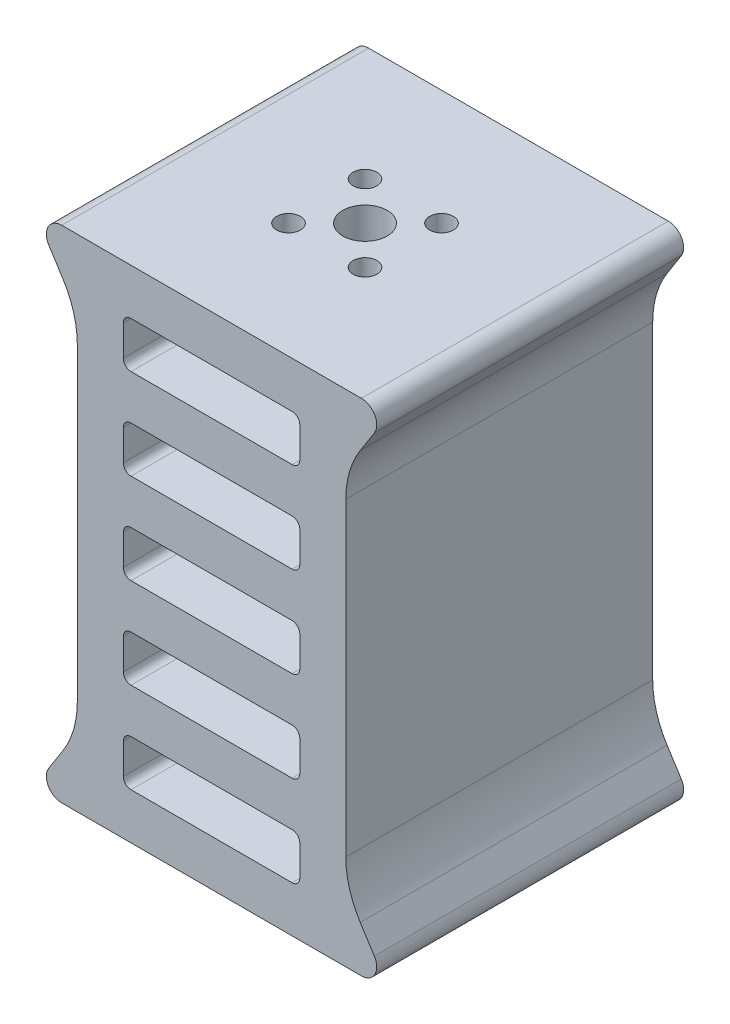
from build123d import *

# Parameters (mm, degrees)
BOSS_EXTRUDE1_DEPTH      = 20
BOSS_EXTRUDE1_DEPTH_BACK = 20
SKETCH1_W                = 35
SKETCH1_H                = 65.2
CUT_EXTRUDE3_REACH       = 92.614
SKETCH7_R                = 1.55
SKETCH7_R_2              = 2.9
CUT_EXTRUDE4_DEPTH       = 10
BOSS_EXTRUDE2_DEPTH      = 40


with BuildPart() as part:
    # Sketch1 → Boss-Extrude1 (new, two sides: drawn at the far end of the back side and taken through both)
    with BuildSketch(Plane.XY.offset(-BOSS_EXTRUDE1_DEPTH_BACK)):
        with Locations((6.633557164, -45.043181818)):
            Rectangle(SKETCH1_W, SKETCH1_H)
    extrude(amount=BOSS_EXTRUDE1_DEPTH + BOSS_EXTRUDE1_DEPTH_BACK)

    # Sketch5 → Cut-Extrude3 (cut, up to next)
    with BuildSketch(Plane.XY.offset(20), mode=Mode.PRIVATE) as cut_extrude3_sk1:
        with BuildLine():
            Line((-4.866442836, -31.243181818), (-4.866442836, -35.243181818))
            ThreePointArc((-4.866442836, -35.243181818), (-4.573549617, -35.950288599), (-3.866442836, -36.243181818))
            Line((-3.866442836, -36.243181818), (17.133557164, -36.243181818))
            ThreePointArc((17.133557164, -36.243181818), (17.840663945, -35.950288599), (18.133557164, -35.243181818))
            Line((18.133557164, -35.243181818), (18.133557164, -31.243181818))
            ThreePointArc((18.133557164, -31.243181818), (17.840663945, -30.536075037), (17.133557164, -30.243181818))
            Line((17.133557164, -30.243181818), (-3.866442836, -30.243181818))
            ThreePointArc((-3.866442836, -30.243181818), (-4.573549617, -30.536075037), (-4.866442836, -31.243181818))
        make_face()
    cut_extrude3_tool1 = extrude(cut_extrude3_sk1.sketch, amount=-CUT_EXTRUDE3_REACH, mode=Mode.PRIVATE) & part.part
    # Sketch5 → Cut-Extrude3 (cut, up to next)
    with BuildSketch(Plane.XY.offset(20), mode=Mode.PRIVATE) as cut_extrude3_sk2:
        with BuildLine():
            Line((-4.866442836, -43.043181818), (-4.866442836, -47.043181818))
            ThreePointArc((-4.866442836, -47.043181818), (-4.573549617, -47.750288599), (-3.866442836, -48.043181818))
            Line((-3.866442836, -48.043181818), (17.133557164, -48.043181818))
            ThreePointArc((17.133557164, -48.043181818), (17.840663945, -47.750288599), (18.133557164, -47.043181818))
            Line((18.133557164, -47.043181818), (18.133557164, -43.043181818))
            ThreePointArc((18.133557164, -43.043181818), (17.840663945, -42.336075037), (17.133557164, -42.043181818))
            Line((17.133557164, -42.043181818), (-3.866442836, -42.043181818))
            ThreePointArc((-3.866442836, -42.043181818), (-4.573549617, -42.336075037), (-4.866442836, -43.043181818))
        make_face()
    cut_extrude3_tool2 = extrude(cut_extrude3_sk2.sketch, amount=-CUT_EXTRUDE3_REACH, mode=Mode.PRIVATE) & part.part
    # Sketch5 → Cut-Extrude3 (cut, up to next)
    with BuildSketch(Plane.XY.offset(20), mode=Mode.PRIVATE) as cut_extrude3_sk3:
        with BuildLine():
            Line((-3.866442836, -18.443181818), (17.133557164, -18.443181818))
            ThreePointArc((17.133557164, -18.443181818), (17.840663945, -18.736075037), (18.133557164, -19.443181818))
            Line((18.133557164, -19.443181818), (18.133557164, -23.443181818))
            ThreePointArc((18.133557164, -23.443181818), (17.840663945, -24.150288599), (17.133557164, -24.443181818))
            Line((17.133557164, -24.443181818), (-3.866442836, -24.443181818))
            ThreePointArc((-3.866442836, -24.443181818), (-4.573549617, -24.150288599), (-4.866442836, -23.443181818))
            Line((-4.866442836, -23.443181818), (-4.866442836, -19.443181818))
            ThreePointArc((-4.866442836, -19.443181818), (-4.573549617, -18.736075037), (-3.866442836, -18.443181818))
        make_face()
    cut_extrude3_tool3 = extrude(cut_extrude3_sk3.sketch, amount=-CUT_EXTRUDE3_REACH, mode=Mode.PRIVATE) & part.part
    # Sketch5 → Cut-Extrude3 (cut, up to next)
    with BuildSketch(Plane.XY.offset(20), mode=Mode.PRIVATE) as cut_extrude3_sk4:
        with BuildLine():
            Line((-4.866442836, -54.843181818), (-4.866442836, -58.843181818))
            ThreePointArc((-4.866442836, -58.843181818), (-4.573549617, -59.550288599), (-3.866442836, -59.843181818))
            Line((-3.866442836, -59.843181818), (17.133557164, -59.843181818))
            ThreePointArc((17.133557164, -59.843181818), (17.840663945, -59.550288599), (18.133557164, -58.843181818))
            Line((18.133557164, -58.843181818), (18.133557164, -54.843181818))
            ThreePointArc((18.133557164, -54.843181818), (17.840663945, -54.136075037), (17.133557164, -53.843181818))
            Line((17.133557164, -53.843181818), (-3.866442836, -53.843181818))
            ThreePointArc((-3.866442836, -53.843181818), (-4.573549617, -54.136075037), (-4.866442836, -54.843181818))
        make_face()
    cut_extrude3_tool4 = extrude(cut_extrude3_sk4.sketch, amount=-CUT_EXTRUDE3_REACH, mode=Mode.PRIVATE) & part.part
    # Sketch5 → Cut-Extrude3 (cut, up to next)
    with BuildSketch(Plane.XY.offset(20), mode=Mode.PRIVATE) as cut_extrude3_sk5:
        with BuildLine():
            Line((-4.866442836, -66.643181818), (-4.866442836, -70.643181818))
            ThreePointArc((-4.866442836, -70.643181818), (-4.573549617, -71.350288599), (-3.866442836, -71.643181818))
            Line((-3.866442836, -71.643181818), (17.133557164, -71.643181818))
            ThreePointArc((17.133557164, -71.643181818), (17.840663945, -71.350288599), (18.133557164, -70.643181818))
            Line((18.133557164, -70.643181818), (18.133557164, -66.643181818))
            ThreePointArc((18.133557164, -66.643181818), (17.840663945, -65.936075037), (17.133557164, -65.643181818))
            Line((17.133557164, -65.643181818), (-3.866442836, -65.643181818))
            ThreePointArc((-3.866442836, -65.643181818), (-4.573549617, -65.936075037), (-4.866442836, -66.643181818))
        make_face()
    cut_extrude3_tool5 = extrude(cut_extrude3_sk5.sketch, amount=-CUT_EXTRUDE3_REACH, mode=Mode.PRIVATE) & part.part
    add(cut_extrude3_tool1.solids().sort_by_distance((6.633557, -33.243182, 20))[0], mode=Mode.SUBTRACT)
    add(cut_extrude3_tool2.solids().sort_by_distance((6.633557, -45.043182, 20))[0], mode=Mode.SUBTRACT)
    add(cut_extrude3_tool3.solids().sort_by_distance((6.633557, -21.443182, 20))[0], mode=Mode.SUBTRACT)
    add(cut_extrude3_tool4.solids().sort_by_distance((6.633557, -56.843182, 20))[0], mode=Mode.SUBTRACT)
    add(cut_extrude3_tool5.solids().sort_by_distance((6.633557, -68.643182, 20))[0], mode=Mode.SUBTRACT)

    # Sketch7 → Cut-Extrude4 (cut)
    with BuildSketch(Plane(origin=(0, -12.443181818, 0), x_dir=(1, 0, 0), z_dir=(0, 1, 0))):
        with Locations(Location((1.648454357, 4.985102807, 0), (0, 0, 270))):
            Circle(SKETCH7_R)
        with Locations(Location((6.633557164, 0, 0), (0, 0, 270))):
            Circle(SKETCH7_R_2)
        with Locations(Location((11.618659971, 4.985102807, 0), (0, 0, 270))):
            Circle(SKETCH7_R)
        with Locations(Location((11.618659971, -4.985102807, 0), (0, 0, 270))):
            Circle(SKETCH7_R)
        with Locations(Location((1.648454357, -4.985102807, 0), (0, 0, 270))):
            Circle(SKETCH7_R)
    cut_extrude4 = extrude(amount=-CUT_EXTRUDE4_DEPTH, mode=Mode.SUBTRACT)

    # Mirror5: Cut-Extrude4 across plane
    add(cut_extrude4.mirror(Plane.ZX.offset(-45.043181818)), mode=Mode.SUBTRACT)

    # Sketch9 → Boss-Extrude2 (add)
    with BuildSketch(Plane(origin=(0, 0, -20), x_dir=(-1, 0, 0), z_dir=(0, 0, -1))):
        with BuildLine():
            Line((-24.133557164, -24.855210359), (-24.133557164, -12.443181818))
            Line((-24.133557164, -12.443181818), (-26.165618229, -12.443181818))
            ThreePointArc((-26.165618229, -12.443181818), (-27.91889587, -13.480883782), (-27.852793861, -15.517164307))
            Line((-27.852793861, -15.517164307), (-26.01050337, -18.411315428))
            ThreePointArc((-26.01050337, -18.411315428), (-24.612345302, -21.499368105), (-24.133557164, -24.855210359))
        make_face()
        with BuildLine():
            Line((-24.133557164, -77.643181818), (-24.133557164, -65.231153277))
            ThreePointArc((-24.133557164, -65.231153277), (-24.612345302, -68.586995532), (-26.01050337, -71.675048209))
            Line((-26.01050337, -71.675048209), (-27.852793861, -74.56919933))
            ThreePointArc((-27.852793861, -74.56919933), (-27.91889587, -76.605479855), (-26.165618229, -77.643181818))
            Line((-26.165618229, -77.643181818), (-24.133557164, -77.643181818))
        make_face()
        with BuildLine():
            Line((10.866442836, -65.231153277), (10.866442836, -77.643181818))
            Line((10.866442836, -77.643181818), (12.898503901, -77.643181818))
            ThreePointArc((12.898503901, -77.643181818), (14.651781542, -76.605479855), (14.585679533, -74.56919933))
            Line((14.585679533, -74.56919933), (12.743389042, -71.675048209))
            ThreePointArc((12.743389042, -71.675048209), (11.345230974, -68.586995532), (10.866442836, -65.231153277))
        make_face()
        with BuildLine():
            Line((10.866442836, -12.443181818), (10.866442836, -24.855210359))
            ThreePointArc((10.866442836, -24.855210359), (11.345230974, -21.499368105), (12.743389042, -18.411315428))
            Line((12.743389042, -18.411315428), (14.585679533, -15.517164307))
            ThreePointArc((14.585679533, -15.517164307), (14.651781542, -13.480883782), (12.898503901, -12.443181818))
            Line((12.898503901, -12.443181818), (10.866442836, -12.443181818))
        make_face()
    extrude(amount=-BOSS_EXTRUDE2_DEPTH)


solid = part.part
